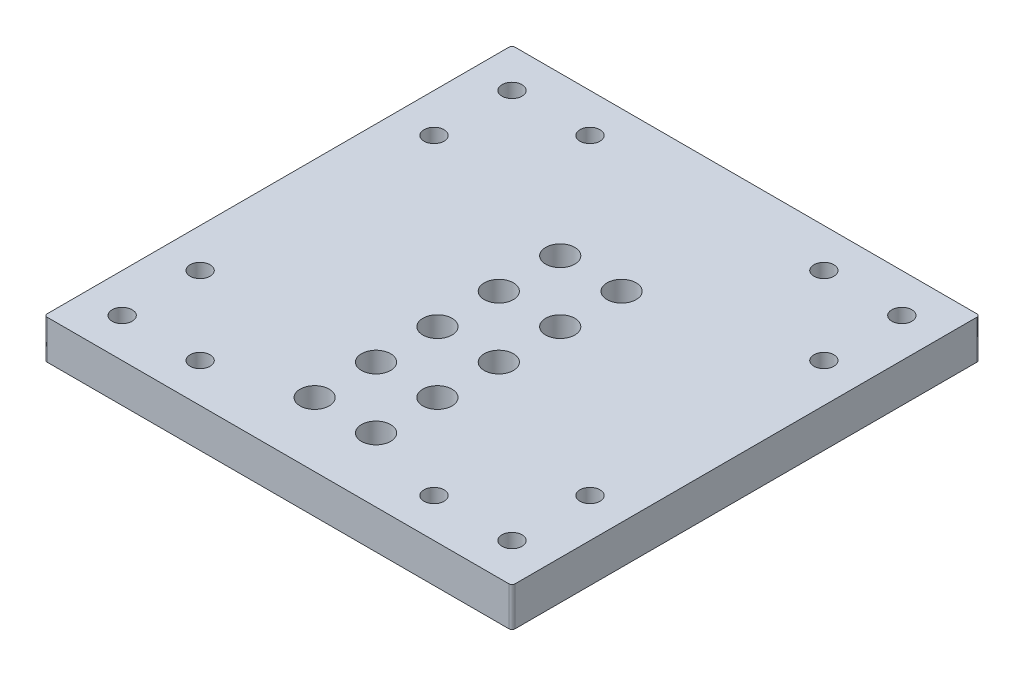
from build123d import *

# Parameters (mm, degrees)
SKETCH1_W           = 152.4
SKETCH1_H           = 152.4
SKETCH1_R           = 4.75
BOSS_EXTRUDE1_DEPTH = 12.7
FILLET1_R           = 1
SKETCH11_R          = 3.2639
CUT_EXTRUDE1_DEPTH  = 12.7
SKETCH12_R          = 4.75
CUT_EXTRUDE2_DEPTH  = 12.7


with BuildPart() as part:
    # Sketch1 → Boss-Extrude1 (new body)
    # profile 1 of 13: a face of its own
    with BuildSketch(Plane(origin=(0, 0, 0), x_dir=(1, 0, 0), z_dir=(0, 1, 0))):
        with Locations((76.2, -76.2)):
            Rectangle(SKETCH1_W, SKETCH1_H)
        with Locations((12.7, -38.1)):
            Circle(SKETCH1_R, mode=Mode.SUBTRACT)
        with Locations((12.7, -114.3)):
            Circle(SKETCH1_R, mode=Mode.SUBTRACT)
        with Locations((38.1, -139.7)):
            Circle(SKETCH1_R, mode=Mode.SUBTRACT)
        with Locations((114.3, -139.7)):
            Circle(SKETCH1_R, mode=Mode.SUBTRACT)
        with Locations((139.7, -114.3)):
            Circle(SKETCH1_R, mode=Mode.SUBTRACT)
        with Locations((139.7, -38.1)):
            Circle(SKETCH1_R, mode=Mode.SUBTRACT)
        with Locations((114.3, -12.7)):
            Circle(SKETCH1_R, mode=Mode.SUBTRACT)
        with Locations((38.1, -12.7)):
            Circle(SKETCH1_R, mode=Mode.SUBTRACT)
        with Locations((12.7, -139.7)):
            Circle(SKETCH1_R, mode=Mode.SUBTRACT)
        with Locations((139.7, -139.7)):
            Circle(SKETCH1_R, mode=Mode.SUBTRACT)
        with Locations((139.7, -12.7)):
            Circle(SKETCH1_R, mode=Mode.SUBTRACT)
        with Locations((12.7, -12.7)):
            Circle(SKETCH1_R, mode=Mode.SUBTRACT)
    # profile 2 of 13: a face of its own
    with BuildSketch(Plane(origin=(0, 0, 0), x_dir=(1, 0, 0), z_dir=(0, 1, 0))):
        with Locations((12.7, -12.7)):
            Circle(SKETCH1_R)
    # profile 3 of 13: a face of its own
    with BuildSketch(Plane(origin=(0, 0, 0), x_dir=(1, 0, 0), z_dir=(0, 1, 0))):
        with Locations((139.7, -12.7)):
            Circle(SKETCH1_R)
    # profile 4 of 13: a face of its own
    with BuildSketch(Plane(origin=(0, 0, 0), x_dir=(1, 0, 0), z_dir=(0, 1, 0))):
        with Locations((139.7, -139.7)):
            Circle(SKETCH1_R)
    # profile 5 of 13: a face of its own
    with BuildSketch(Plane(origin=(0, 0, 0), x_dir=(1, 0, 0), z_dir=(0, 1, 0))):
        with Locations((12.7, -139.7)):
            Circle(SKETCH1_R)
    # profile 6 of 13: a face of its own
    with BuildSketch(Plane(origin=(0, 0, 0), x_dir=(1, 0, 0), z_dir=(0, 1, 0))):
        with Locations((38.1, -12.7)):
            Circle(SKETCH1_R)
    # profile 7 of 13: a face of its own
    with BuildSketch(Plane(origin=(0, 0, 0), x_dir=(1, 0, 0), z_dir=(0, 1, 0))):
        with Locations((12.7, -38.1)):
            Circle(SKETCH1_R)
    # profile 8 of 13: a face of its own
    with BuildSketch(Plane(origin=(0, 0, 0), x_dir=(1, 0, 0), z_dir=(0, 1, 0))):
        with Locations((139.7, -38.1)):
            Circle(SKETCH1_R)
    # profile 9 of 13: a face of its own
    with BuildSketch(Plane(origin=(0, 0, 0), x_dir=(1, 0, 0), z_dir=(0, 1, 0))):
        with Locations((114.3, -12.7)):
            Circle(SKETCH1_R)
    # profile 10 of 13: a face of its own
    with BuildSketch(Plane(origin=(0, 0, 0), x_dir=(1, 0, 0), z_dir=(0, 1, 0))):
        with Locations((139.7, -114.3)):
            Circle(SKETCH1_R)
    # profile 11 of 13: a face of its own
    with BuildSketch(Plane(origin=(0, 0, 0), x_dir=(1, 0, 0), z_dir=(0, 1, 0))):
        with Locations((114.3, -139.7)):
            Circle(SKETCH1_R)
    # profile 12 of 13: a face of its own
    with BuildSketch(Plane(origin=(0, 0, 0), x_dir=(1, 0, 0), z_dir=(0, 1, 0))):
        with Locations((12.7, -114.3)):
            Circle(SKETCH1_R)
    # profile 13 of 13: a face of its own
    with BuildSketch(Plane(origin=(0, 0, 0), x_dir=(1, 0, 0), z_dir=(0, 1, 0))):
        with Locations((38.1, -139.7)):
            Circle(SKETCH1_R)
    extrude(amount=BOSS_EXTRUDE1_DEPTH)

    # Fillet1
    fillet1_edges = [part.edges().sort_by_distance(p)[0] for p in [
        (152.4, 6.35, 152.4),
        (0, 6.35, 152.4),
        (0, 6.35, 0),
        (152.4, 6.35, 0),
    ]]
    fillet(fillet1_edges, radius=FILLET1_R)

    # Sketch11 → Cut-Extrude1 (cut)
    with BuildSketch(Plane(origin=(0, 12.7, 0), x_dir=(1, 0, 0), z_dir=(0, 1, 0))):
        with Locations(Location((38.1, -12.7, 0), (0, 0, 270))):
            Circle(SKETCH11_R)
        with Locations(Location((12.7, -12.7, 0), (0, 0, 270))):
            Circle(SKETCH11_R)
        with Locations(Location((139.7, -12.7, 0), (0, 0, 270))):
            Circle(SKETCH11_R)
        with Locations(Location((12.7, -38.1, 0), (0, 0, 270))):
            Circle(SKETCH11_R)
        with Locations(Location((114.3, -12.7, 0), (0, 0, 270))):
            Circle(SKETCH11_R)
        with Locations(Location((139.7, -38.1, 0), (0, 0, 270))):
            Circle(SKETCH11_R)
        with Locations(Location((139.7, -114.3, 0), (0, 0, 270))):
            Circle(SKETCH11_R)
        with Locations(Location((114.3, -139.7, 0), (0, 0, 270))):
            Circle(SKETCH11_R)
        with Locations(Location((12.7, -114.3, 0), (0, 0, 270))):
            Circle(SKETCH11_R)
        with Locations(Location((38.1, -139.7, 0), (0, 0, 270))):
            Circle(SKETCH11_R)
        with Locations(Location((139.7, -139.7, 0), (0, 0, 270))):
            Circle(SKETCH11_R)
        with Locations(Location((12.7, -139.7, 0), (0, 0, 270))):
            Circle(SKETCH11_R)
    extrude(amount=-CUT_EXTRUDE1_DEPTH, mode=Mode.SUBTRACT)

    # Sketch12 → Cut-Extrude2 (cut)
    with BuildSketch(Plane.XZ):
        with Locations(Location((67.2, 131.495, 0), (0, 0, 270))):
            Circle(SKETCH12_R)
        with Locations(Location((87.2, 131.495, 0), (0, 0, 270))):
            Circle(SKETCH12_R)
        with Locations(Location((87.2, 111.495, 0), (0, 0, 270))):
            Circle(SKETCH12_R)
        with Locations(Location((67.2, 111.495, 0), (0, 0, 270))):
            Circle(SKETCH12_R)
        with Locations(Location((67.2, 91.495, 0), (0, 0, 270))):
            Circle(SKETCH12_R)
        with Locations(Location((67.2, 71.495, 0), (0, 0, 270))):
            Circle(SKETCH12_R)
        with Locations(Location((67.2, 51.495, 0), (0, 0, 270))):
            Circle(SKETCH12_R)
        with Locations(Location((87.2, 51.495, 0), (0, 0, 270))):
            Circle(SKETCH12_R)
        with Locations(Location((87.2, 71.495, 0), (0, 0, 270))):
            Circle(SKETCH12_R)
        with Locations(Location((87.2, 91.495, 0), (0, 0, 270))):
            Circle(SKETCH12_R)
    extrude(amount=-CUT_EXTRUDE2_DEPTH, mode=Mode.SUBTRACT)


solid = part.part
